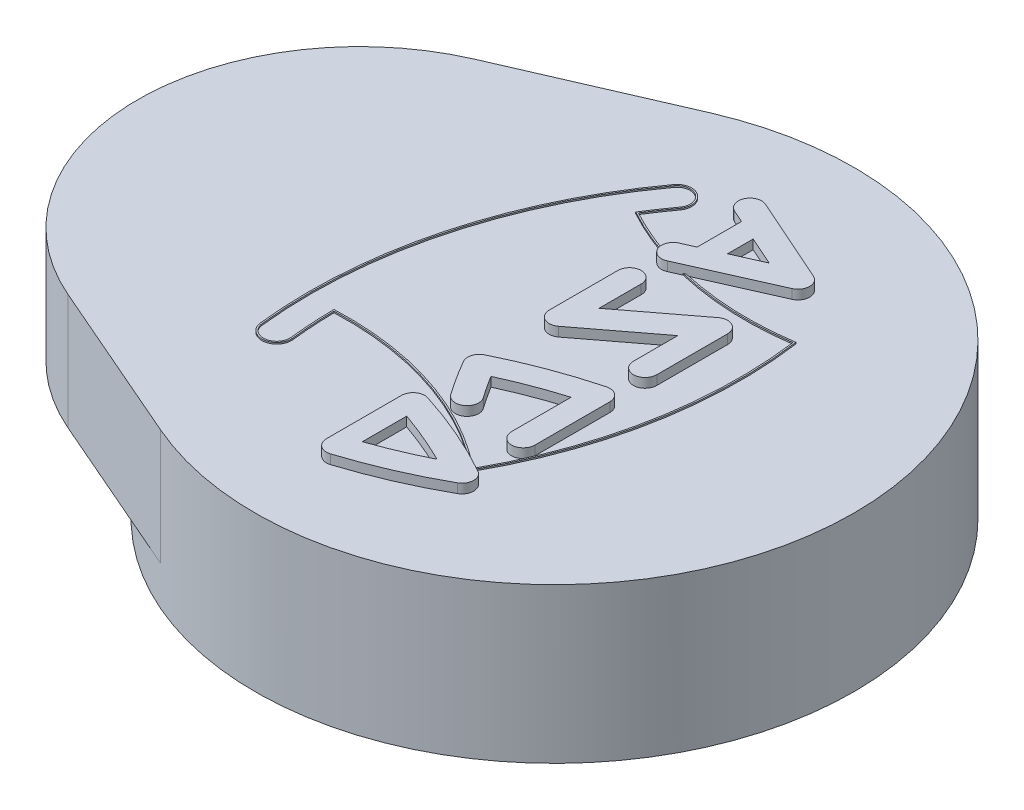
from build123d import *

# Parameters (mm, degrees)
SKETCH1_R           = 6.5151
BOSS_EXTRUDE1_DEPTH = 3.3676
BOSS_EXTRUDE2_START = 2.5146
BOSS_EXTRUDE2_DEPTH = 2.5146
BOSS_EXTRUDE3_DEPTH = 0.03175
BOSS_EXTRUDE4_START = 0.2032
BOSS_EXTRUDE4_DEPTH = 0.2032
BOSS_EXTRUDE5_DEPTH = 0.2032
BOSS_EXTRUDE6_DEPTH = 0.2032
BOSS_EXTRUDE7_START = 0.2032
BOSS_EXTRUDE7_DEPTH = 0.2032


with BuildPart() as part:
    # Sketch1 → Boss-Extrude1 (new body)
    with BuildSketch(Plane(origin=(0, 10.383607632, 0), x_dir=(-1, 0, 0), z_dir=(0, -1, 0))):
        with Locations(Location((-86.1568, 0.188358884, 0), (0, 0, 90))):
            Circle(SKETCH1_R)
    extrude(amount=BOSS_EXTRUDE1_DEPTH)

    # Sketch2 → Boss-Extrude2 (add)
    with BuildSketch(Plane(origin=(0, 7.869007632, 0), x_dir=(1, 0, 0), z_dir=(0, 1, 0)).offset(BOSS_EXTRUDE2_START)):
        with BuildLine():
            Line((83.562463772, 6.164640968), (79.993269461, 4.615234502))
            ThreePointArc((79.993269461, 4.615234502), (77.089, 0.188358884), (79.993269461, -4.238516734))
            Line((79.993269461, -4.238516734), (83.562463772, -5.7879232))
            ThreePointArc((83.562463772, -5.7879232), (92.6719, 0.188358884), (83.562463772, 6.164640968))
        make_face()
    extrude(amount=-BOSS_EXTRUDE2_DEPTH)

    # Sketch3 → Boss-Extrude3 (add)
    with BuildSketch(Plane(origin=(0, 10.415357632, 0), x_dir=(1, 0, 0), z_dir=(0, 1, 0))):
        with BuildLine():
            Line((86.379362148, 2.834929745), (86.331172499, 2.813512123))
            ThreePointArc((86.331172499, 2.813512123), (87.57388973, 2.642364143), (88.826675515, 2.706905023))
            ThreePointArc((88.826675515, 2.706905023), (88.743147222, -0.307968876), (87.717246323, -3.144158035))
            ThreePointArc((87.717246323, -3.144158035), (85.599615489, -1.990016157), (83.209989222, -1.664301363))
            ThreePointArc((83.209989222, -1.664301363), (83.226670097, -2.157743319), (83.268922831, -2.649655834))
            ThreePointArc((83.268922831, -2.649655834), (83.013982099, -2.96896843), (82.694669503, -2.714027698))
            ThreePointArc((82.694669503, -2.714027698), (82.970684724, 1.003656964), (84.577363687, 4.367575269))
            ThreePointArc((84.577363687, 4.367575269), (84.981125023, 4.430281687), (85.043831441, 4.026520351))
            ThreePointArc((85.043831441, 4.026520351), (84.845175329, 3.744205128), (84.656890151, 3.45486998))
            ThreePointArc((84.656890151, 3.45486998), (85.187045427, 3.19462014), (85.738141542, 2.982281574))
            ThreePointArc((85.738141542, 2.982281574), (85.741341744, 2.997904944), (85.745516089, 3.013296689))
            ThreePointArc((85.745516089, 3.013296689), (85.213902251, 3.217551458), (84.701749715, 3.466615834))
            ThreePointArc((84.701749715, 3.466615834), (84.880937437, 3.740370401), (85.069461538, 4.00778107))
            ThreePointArc((85.069461538, 4.00778107), (84.999864331, 4.455911764), (84.551733629, 4.386314602))
            ThreePointArc((84.551733629, 4.386314602), (82.940000597, 1.01181459), (82.663117122, -2.717564614))
            ThreePointArc((82.663117122, -2.717564614), (83.017519015, -3.000520811), (83.300475212, -2.646118918))
            ThreePointArc((83.300475212, -2.646118918), (83.259289868, -2.171130031), (83.242027928, -1.694671533))
            ThreePointArc((83.242027928, -1.694671533), (85.576128395, -2.015738406), (87.651108795, -3.131787359))
            ThreePointArc((87.651108795, -3.131787359), (87.69360158, -3.153679255), (87.735992687, -3.175767397))
            ThreePointArc((87.735992687, -3.175767397), (88.775617442, -0.307140697), (88.853849034, 2.743059067))
            ThreePointArc((88.853849034, 2.743059067), (87.612284437, 2.672606475), (86.379362148, 2.834929745))
        make_face()
    extrude(amount=-BOSS_EXTRUDE3_DEPTH)

    # Sketch4 → Boss-Extrude4 (add)
    with BuildSketch(Plane(origin=(0, 10.383607632, 0), x_dir=(1, 0, 0), z_dir=(0, 1, 0)).offset(BOSS_EXTRUDE4_START)):
        with BuildLine():
            Line((87.971211641, 4.006634675), (86.091611641, 4.842012453))
            ThreePointArc((86.091611641, 4.842012453), (85.756344283, 4.713063514), (85.8852933, 4.377796186))
            Line((85.8852933, 4.377796186), (86.1568, 4.257126542))
            Line((86.1568, 4.257126542), (86.1568, 3.291926542))
            Line((86.1568, 3.291926542), (85.8852933, 3.171256897))
            ThreePointArc((85.8852933, 3.171256897), (85.756344337, 2.835989594), (86.091611641, 2.707040631))
            Line((86.091611641, 2.707040631), (87.971211641, 3.542418409))
            ThreePointArc((87.971211641, 3.542418409), (88.12205247, 3.774526542), (87.971211641, 4.006634675))
        make_face()
        Polygon((87.24265, 3.774526542), (86.614, 4.053926542), (86.614, 3.495126542), align=None, mode=Mode.SUBTRACT)
    extrude(amount=-BOSS_EXTRUDE4_DEPTH)

    # Sketch5 → Boss-Extrude5 (add)
    with BuildSketch(Plane(origin=(0, 10.383607632, 0), x_dir=(1, 0, 0), z_dir=(0, 1, 0))):
        with BuildLine():
            Line((88.12205247, 0.447338975), (88.12205247, 1.988743646))
            ThreePointArc((88.12205247, 1.988743646), (87.980866694, 2.216315505), (87.714265455, 2.19089595))
            Line((87.714265455, 2.19089595), (86.24245247, 1.071216772))
            Line((86.24245247, 1.071216772), (86.24245247, 1.988743646))
            ThreePointArc((86.24245247, 1.988743646), (85.98845247, 2.242743706), (85.73445247, 1.988743646))
            Line((85.73445247, 1.988743646), (85.73445247, 0.495012101))
            ThreePointArc((85.73445247, 0.495012101), (85.875638247, 0.267440242), (86.142239485, 0.292859797))
            Line((86.142239485, 0.292859797), (87.61405247, 1.412538975))
            Line((87.61405247, 1.412538975), (87.61405247, 0.447338975))
            ThreePointArc((87.61405247, 0.447338975), (87.86805247, 0.193338975), (88.12205247, 0.447338975))
        make_face()
    extrude(amount=BOSS_EXTRUDE5_DEPTH)

    # Sketch6 → Boss-Extrude6 (add)
    with BuildSketch(Plane(origin=(0, 10.383607632, 0), x_dir=(1, 0, 0), z_dir=(0, 1, 0))):
        with BuildLine():
            Line((88.12205247, -2.20349139), (88.12205247, -0.573641116))
            ThreePointArc((88.12205247, -0.573641116), (88.022972158, -0.372355522), (87.803029713, -0.328104884))
            ThreePointArc((87.803029713, -0.328104884), (86.82154331, -0.641121728), (85.876084624, -1.050270813))
            ThreePointArc((85.876084624, -1.050270813), (85.745367006, -1.204405708), (85.76854522, -1.405172817))
            ThreePointArc((85.76854522, -1.405172817), (86.002778478, -1.790740386), (86.25361081, -2.165721333))
            ThreePointArc((86.25361081, -2.165721333), (86.607396093, -2.227914435), (86.669589172, -1.874129148))
            ThreePointArc((86.669589172, -1.874129148), (86.505953581, -1.633172635), (86.349528836, -1.387473738))
            ThreePointArc((86.349528836, -1.387473738), (86.973563185, -1.12669528), (87.61405247, -0.909444852))
            Line((87.61405247, -0.909444852), (87.61405247, -2.20349139))
            ThreePointArc((87.61405247, -2.20349139), (87.86805247, -2.45749139), (88.12205247, -2.20349139))
        make_face()
    extrude(amount=BOSS_EXTRUDE6_DEPTH)

    # Sketch7 → Boss-Extrude7 (add)
    with BuildSketch(Plane(origin=(0, 10.383607632, 0), x_dir=(1, 0, 0), z_dir=(0, 1, 0)).offset(BOSS_EXTRUDE7_START)):
        with BuildLine():
            Line((85.73445247, -2.721325206), (85.73445247, -4.351175481))
            ThreePointArc((85.73445247, -4.351175481), (85.838455656, -4.55615586), (86.065294641, -4.593273149))
            ThreePointArc((86.065294641, -4.593273149), (87.050038854, -4.224609495), (87.992239729, -3.75782093))
            ThreePointArc((87.992239729, -3.75782093), (88.12205247, -3.536250363), (87.992239763, -3.314679777))
            ThreePointArc((87.992239763, -3.314679777), (87.050038872, -2.8478912), (86.065294641, -2.479227539))
            ThreePointArc((86.065294641, -2.479227539), (85.838455656, -2.516344828), (85.73445247, -2.721325206))
        make_face()
        with BuildLine():
            Line((86.1822, -3.053650344), (86.1822, -4.018850344))
            ThreePointArc((86.1822, -4.018850344), (86.761323847, -3.795601976), (87.325204148, -3.536250344))
            ThreePointArc((87.325204148, -3.536250344), (86.761323847, -3.276898711), (86.1822, -3.053650344))
        make_face(mode=Mode.SUBTRACT)
    extrude(amount=-BOSS_EXTRUDE7_DEPTH)


solid = part.part
